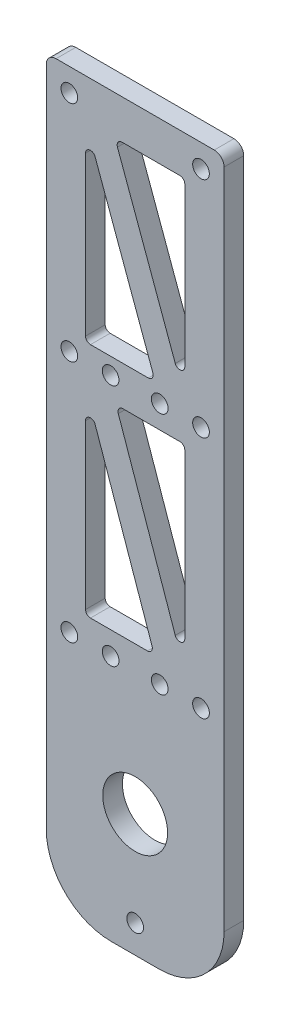
from build123d import *

# Parameters (mm, degrees)
SKETCH1_R           = 6.6
SKETCH1_W           = 20.2
SKETCH1_H           = 40.2
BASE_PLATE_DEPTH    = 4
FILLET1_R           = 1
FILLET2_R           = 2
SKETCH2_R           = 1.7
CUT_EXTRUDE1_DEPTH  = 78.256779638
SKETCH3_W           = 4
SKETCH3_H           = 40.2
BOSS_EXTRUDE1_DEPTH = 28.2
CUT_EXTRUDE2_DEPTH  = 78.256779638
FILLET3_R           = 1


with BuildPart() as part:
    # Sketch1 → Base Plate (new body)
    with BuildSketch(Plane.XY):
        with BuildLine():
            Line((-4.9, -75), (4.9, -75))
            ThreePointArc((4.9, -75), (14.233809512, -71.133809512), (18.1, -61.8))
            Line((18.1, -61.8), (18.1, 75))
            Line((18.1, 75), (-18.1, 75))
            Line((-18.1, 75), (-18.1, -61.8))
            ThreePointArc((-18.1, -61.8), (-14.233809512, -71.133809512), (-4.9, -75))
        make_face()
        with Locations((0, -50.1)):
            Circle(SKETCH1_R, mode=Mode.SUBTRACT)
        Polygon((-10.1, 28.1), (4.1, 28.1), (-10.1, 67), align=None, mode=Mode.SUBTRACT)
        Rectangle(SKETCH1_W, SKETCH1_H, mode=Mode.SUBTRACT)
        Polygon((10.1, 67), (-4.1, 67), (10.1, 28.1), align=None, mode=Mode.SUBTRACT)
    extrude(amount=BASE_PLATE_DEPTH)

    # Fillet1
    fillet1_edges = [part.edges().sort_by_distance(p)[0] for p in [
        (10.1, 28.1, 2),
        (10.1, 67, 2),
        (-4.1, 67, 2),
        (-10.1, 67, 2),
        (-10.1, 28.1, 2),
        (4.1, 28.1, 2),
    ]]
    fillet(fillet1_edges, radius=FILLET1_R)

    # Fillet2
    fillet2_edges = [part.edges().sort_by_distance(p)[0] for p in [
        (-18.1, 75, 2),
        (18.1, 75, 2),
    ]]
    fillet(fillet2_edges, radius=FILLET2_R)

    # Sketch2 → Cut-Extrude1 (cut, through all)
    with BuildSketch(Plane.XY.offset(4)):
        with Locations((5, 24.75)):
            Circle(SKETCH2_R)
        with Locations((-5, 24.75)):
            Circle(SKETCH2_R)
        with Locations(Location((-5, -24.75, 0), (0, 0, 180))):
            Circle(SKETCH2_R)
        with Locations(Location((5, -24.75, 0), (0, 0, 180))):
            Circle(SKETCH2_R)
        with Locations((13.4, 24.75)):
            Circle(SKETCH2_R)
        with Locations(Location((-13.4, 24.75, 0), (0, 0, 180))):
            Circle(SKETCH2_R)
        with Locations(Location((13.4, -24.75, 0), (0, 0, 180))):
            Circle(SKETCH2_R)
        with Locations((-13.4, -24.75)):
            Circle(SKETCH2_R)
        with Locations((13.4, 70.3)):
            Circle(SKETCH2_R)
        with Locations(Location((-13.4, 70.3, 0), (0, 0, 180))):
            Circle(SKETCH2_R)
        with Locations((0, -69.3)):
            Circle(SKETCH2_R)
    extrude(amount=-CUT_EXTRUDE1_DEPTH, mode=Mode.SUBTRACT)

    # Sketch3 → Boss-Extrude1 (add, through all)
    with BuildSketch(Plane.ZY.offset(-10.1)):
        with Locations((2, 0)):
            Rectangle(SKETCH3_W, SKETCH3_H)
    extrude(amount=BOSS_EXTRUDE1_DEPTH)

    # Sketch4 → Cut-Extrude2 (cut, through all)
    with BuildSketch(Plane.XY.offset(4)):
        Polygon((-10.1, 20.1), (-10.1, -20.1), (3.9, -20.1), align=None)
        Polygon((-3.9, 20.1), (10.1, 20.1), (10.1, -20.1), align=None)
    extrude(amount=-CUT_EXTRUDE2_DEPTH, mode=Mode.SUBTRACT)

    # Fillet3
    fillet3_edges = [part.edges().sort_by_distance(p)[0] for p in [
        (10.1, -20.1, 2),
        (-3.9, 20.1, 2),
        (10.1, 20.1, 2),
        (-10.1, 20.1, 2),
        (3.9, -20.1, 2),
        (-10.1, -20.1, 2),
    ]]
    fillet(fillet3_edges, radius=FILLET3_R)


solid = part.part
